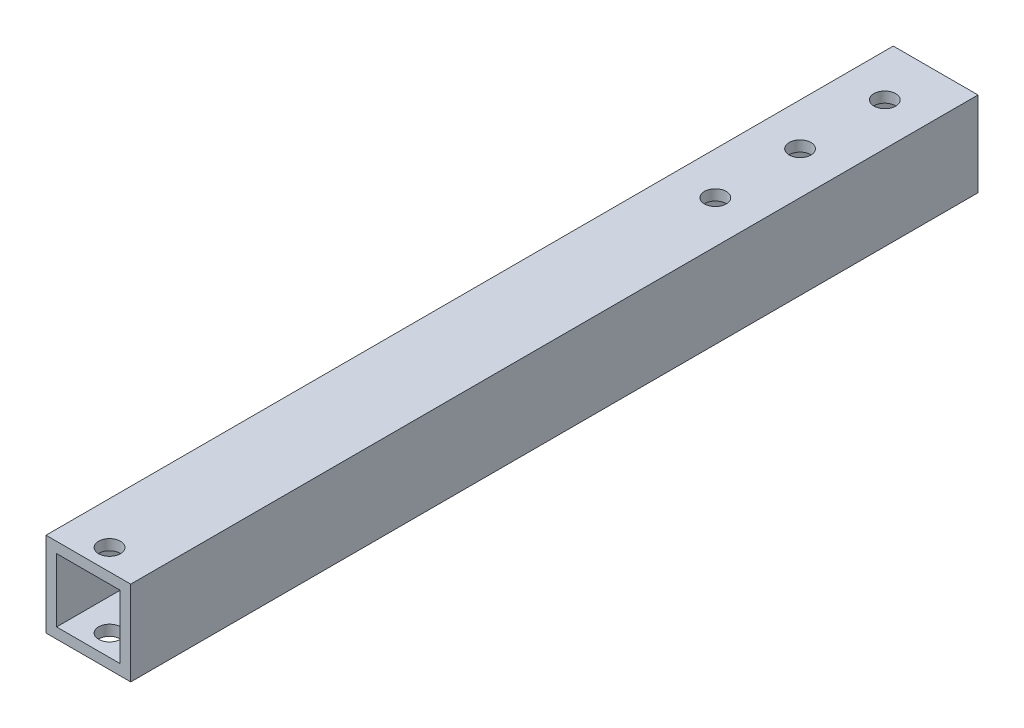
from build123d import *

# Parameters (mm, degrees)
SKETCH2_W           = 25.4
SKETCH2_H           = 25.4
BOSS_EXTRUDE1_DEPTH = 254
SKETCH4_W           = 19.05
SKETCH4_H           = 19.05
CUT_EXTRUDE1_DEPTH  = 255.634208228
SKETCH5_R           = 3.2639
CUT_EXTRUDE2_DEPTH  = 304.8
SKETCH6_R           = 3.2639
CUT_EXTRUDE3_DEPTH  = 256.582569828
SKETCH8_R           = 3.2639
CUT_EXTRUDE4_DEPTH  = 256.582569828


with BuildPart() as part:
    # Sketch2 → Boss-Extrude1 (new body)
    with BuildSketch(Plane.XY):
        Rectangle(SKETCH2_W, SKETCH2_H)
    extrude(amount=BOSS_EXTRUDE1_DEPTH)

    # Sketch4 → Cut-Extrude1 (cut, through all)
    with BuildSketch(Plane.XY):
        Rectangle(SKETCH4_W, SKETCH4_H)
    extrude(amount=CUT_EXTRUDE1_DEPTH, mode=Mode.SUBTRACT)

    # Sketch5 → Cut-Extrude2 (cut)
    with BuildSketch(Plane(origin=(0, 12.7, 0), x_dir=(1, 0, 0), z_dir=(0, 1, 0))):
        with Locations(Location((0, -15.24, 0), (0, 0, 270))):
            Circle(SKETCH5_R)
    extrude(amount=-CUT_EXTRUDE2_DEPTH, mode=Mode.SUBTRACT)

    # Sketch6 → Cut-Extrude3 (cut, through all)
    with BuildSketch(Plane(origin=(0, 12.7, 0), x_dir=(1, 0, 0), z_dir=(0, 1, 0))):
        with Locations(Location((0, -247.65, 0), (0, 0, 270))):
            Circle(SKETCH6_R)
    extrude(amount=-CUT_EXTRUDE3_DEPTH, mode=Mode.SUBTRACT)

    # Sketch8 → Cut-Extrude4 (cut, through all)
    with BuildSketch(Plane(origin=(0, 12.7, 0), x_dir=(1, 0, 0), z_dir=(0, 1, 0))):
        with Locations(Location((0, -66.04, 0), (0, 0, 270))):
            Circle(SKETCH8_R)
        with Locations(Location((0, -40.64, 0), (0, 0, 270))):
            Circle(SKETCH8_R)
    extrude(amount=-CUT_EXTRUDE4_DEPTH, mode=Mode.SUBTRACT)


solid = part.part
